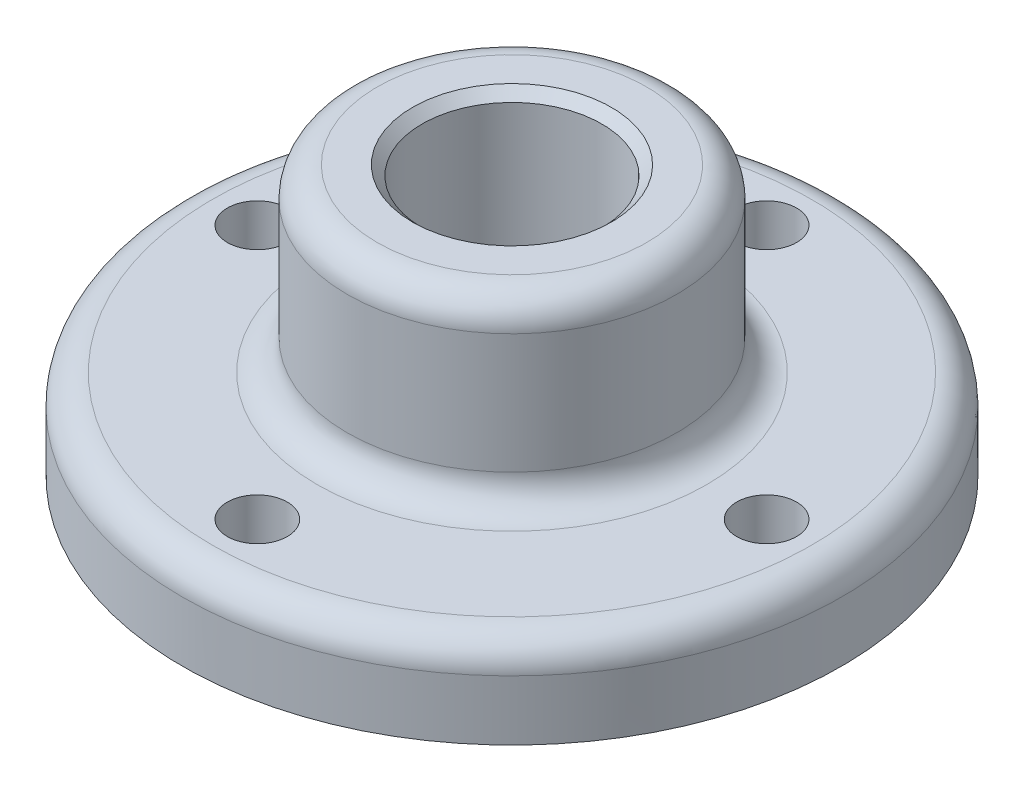
from build123d import *

# Parameters (mm, degrees)
SKETCH2_R          = 19.05
CUT_EXTRUDE1_DEPTH = 115.123474798
SKETCH3_R          = 6.35
CUT_EXTRUDE2_DEPTH = 19.05
FILLET1_R          = 6.35
CHAMFER1_SIZE      = 2.032


with BuildPart() as part:
    # Sketch1 → Revolve1 (revolve)
    with BuildSketch(Plane.XY, mode=Mode.PRIVATE) as revolve1_sk:
        Polygon((0, 0), (69.85, 0), (69.85, 19.05), (34.925, 19.05), (34.925, 57.15), (0, 57.15), align=None)
    revolve(revolve1_sk.sketch.rotate(Axis((0, 0, 0), (0, 1, 0)), 90), axis=Axis((0, 0, 0), (0, 1, 0)))

    # Sketch2 → Cut-Extrude1 (cut, through all)
    with BuildSketch(Plane(origin=(0, 57.15, 0), x_dir=(1, 0, 0), z_dir=(0, 1, 0))):
        with Locations(Location((0, 0, 0), (0, 0, 270))):
            Circle(SKETCH2_R)
    extrude(amount=-CUT_EXTRUDE1_DEPTH, mode=Mode.SUBTRACT)

    # Sketch3 → Cut-Extrude2 (cut)
    with BuildSketch(Plane(origin=(0, 19.05, 0), x_dir=(1, 0, 0), z_dir=(0, 1, 0))):
        with Locations(Location((0, 53.975, 0), (0, 0, 270))):
            Circle(SKETCH3_R)
        with Locations(Location((53.975, 0, 0), (0, 0, 270))):
            Circle(SKETCH3_R)
        with Locations(Location((0, -53.975, 0), (0, 0, 270))):
            Circle(SKETCH3_R)
        with Locations(Location((-53.975, 0, 0), (0, 0, 270))):
            Circle(SKETCH3_R)
    extrude(amount=-CUT_EXTRUDE2_DEPTH, mode=Mode.SUBTRACT)

    # Fillet1
    fillet1_edges = [part.edges().sort_by_distance(p)[0] for p in [
        (0, 57.15, 34.925),
        (0, 19.05, 34.925),
        (0, 19.05, 69.85),
    ]]
    fillet(fillet1_edges, radius=FILLET1_R)

    # Chamfer1
    chamfer1_edges = [part.edges().sort_by_distance(p)[0] for p in [
        (0, 57.15, -19.05),
    ]]
    chamfer(chamfer1_edges, length=CHAMFER1_SIZE)


solid = part.part
